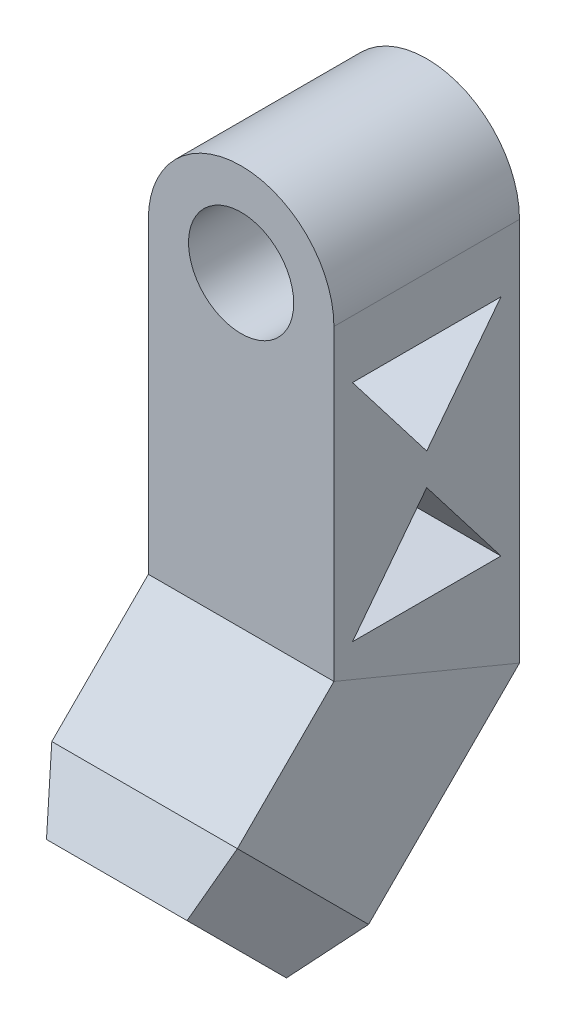
from build123d import *

# Parameters (mm, degrees)
SKETCH11_W          = 38.1
SKETCH11_H          = 38.1
SKETCH12_W          = 38.1
SKETCH12_H          = 38.1
BOSS_EXTRUDE5_DEPTH = 12.7
BOSS_EXTRUDE5_TAPER = 20
BOSS_EXTRUDE6_DEPTH = 38.1
SKETCH14_R          = 10.795
CUT_EXTRUDE2_DEPTH  = 38.1
SKETCH15_R          = 10.795
CUT_EXTRUDE3_DEPTH  = 12.7
CUT_EXTRUDE4_DEPTH  = 38.1


with BuildPart() as part:
    # Sweep1: sweep along a path in Sketch10
    with BuildLine(Plane(origin=(0, 0, 0), x_dir=(0, 0, -1), z_dir=(1, 0, 0))) as sweep1_path:
        Line((0, 96.393), (0, 25.4))
        Line((0, 25.4), (-25.4, 0))
    # Sketch11 → Sweep1 (sweep)
    with BuildSketch(Plane(origin=(0, 96.393, 0), x_dir=(1, 0, 0), z_dir=(0, 1, 0))):
        Rectangle(SKETCH11_W, SKETCH11_H)
    sweep(path=sweep1_path.line, transition=Transition.RIGHT)

    # Sketch12 → Boss-Extrude5 (add)
    with BuildSketch(Plane(origin=(0, -12.7, 12.7), x_dir=(1, 0, 0), z_dir=(0, -0.7071067811865461, 0.7071067811865489))):
        with Locations((0, 17.960512242)):
            Rectangle(SKETCH12_W, SKETCH12_H)
    extrude(amount=BOSS_EXTRUDE5_DEPTH, taper=BOSS_EXTRUDE5_TAPER)

    # Sketch13 → Boss-Extrude6 (add)
    with BuildSketch(Plane(origin=(0, 0, -19.05), x_dir=(-1, 0, 0), z_dir=(0, 0, -1))):
        with BuildLine():
            Line((-19.05, 96.393), (19.05, 96.393))
            ThreePointArc((19.05, 96.393), (0, 115.443), (-19.05, 96.393))
        make_face()
    extrude(amount=-BOSS_EXTRUDE6_DEPTH)

    # Sketch14 → Cut-Extrude2 (cut)
    with BuildSketch(Plane.XY.offset(19.05)):
        with Locations((0, 96.393)):
            Circle(SKETCH14_R)
    extrude(amount=-CUT_EXTRUDE2_DEPTH, mode=Mode.SUBTRACT)

    # Sketch15 → Cut-Extrude3 (cut)
    with BuildSketch(Plane(origin=(0, -21.680256121, 21.680256121), x_dir=(1, 0, 0), z_dir=(0, -0.7071067811865461, 0.7071067811865489))):
        with Locations(Location((0, 17.960512242, 0), (0, 0, 270))):
            Circle(SKETCH15_R)
    extrude(amount=-CUT_EXTRUDE3_DEPTH, mode=Mode.SUBTRACT)

    # Sketch16 → Cut-Extrude4 (cut)
    with BuildSketch(Plane.ZY.offset(19.05)):
        Polygon((-15.24, 38.445429874), (0, 58.232827541), (15.24, 38.445429874), align=None)
        Polygon((-15.24, 84.522903194), (15.24, 84.522903194), (0, 64.735505528), align=None)
    extrude(amount=-CUT_EXTRUDE4_DEPTH, mode=Mode.SUBTRACT)


solid = part.part
